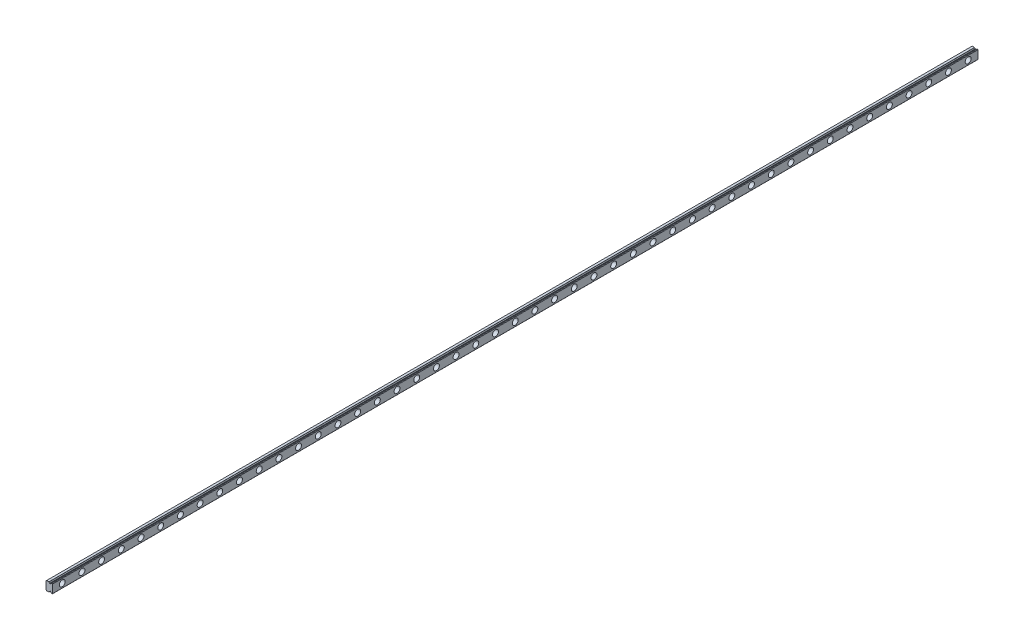
from build123d import *

# Parameters (mm, degrees)
EXTRUDE_1_DEPTH     = 940
SKETCH_2_R          = 3
CUT_EXTRUDE_1_DEPTH = 4.5
SKETCH_3_R          = 1.75
CUT_EXTRUDE_2_DEPTH = 941.05385484


with BuildPart() as part:
    # 草图1 → 凸台-拉伸1 (new body)
    with BuildSketch(Plane.XY):
        with BuildLine():
            Line((0.6, 9), (0, 8.4))
            Line((0, 8.4), (0, 0.6))
            Line((0, 0.6), (0.6, 0))
            Line((0.6, 0), (2.942330317, 0))
            ThreePointArc((2.942330317, 0), (3.055719659, 0.035249106), (3.129140272, 0.128571429))
            ThreePointArc((3.129140272, 0.128571429), (3.369153549, 0.514929157), (3.735714286, 0.784209483))
            ThreePointArc((3.735714286, 0.784209483), (3.819030851, 0.858006567), (3.85, 0.964911064))
            Line((3.85, 0.964911064), (3.85, 1))
            ThreePointArc((3.85, 1), (4.25, 1.4), (4.65, 1))
            Line((4.65, 1), (4.65, 0.964911064))
            ThreePointArc((4.65, 0.964911064), (4.680969149, 0.858006567), (4.764285714, 0.784209483))
            ThreePointArc((4.764285714, 0.784209483), (5.130846451, 0.514929157), (5.370859728, 0.128571429))
            ThreePointArc((5.370859728, 0.128571429), (5.444280341, 0.035249106), (5.557669683, 0))
            Line((5.557669683, 0), (6.2, 0))
            ThreePointArc((6.2, 0), (6.412132034, 0.087867966), (6.5, 0.3))
            Line((6.5, 0.3), (6.5, 8.7))
            ThreePointArc((6.5, 8.7), (6.412132034, 8.912132034), (6.2, 9))
            Line((6.2, 9), (5.557669683, 9))
            ThreePointArc((5.557669683, 9), (5.444280341, 8.964750894), (5.370859728, 8.871428571))
            ThreePointArc((5.370859728, 8.871428571), (5.130846451, 8.485070843), (4.764285714, 8.215790517))
            ThreePointArc((4.764285714, 8.215790517), (4.680969149, 8.141993433), (4.65, 8.035088936))
            Line((4.65, 8.035088936), (4.65, 8))
            ThreePointArc((4.65, 8), (4.25, 7.6), (3.85, 8))
            Line((3.85, 8), (3.85, 8.035088936))
            ThreePointArc((3.85, 8.035088936), (3.819030851, 8.141993433), (3.735714286, 8.215790517))
            ThreePointArc((3.735714286, 8.215790517), (3.369153549, 8.485070843), (3.129140272, 8.871428571))
            ThreePointArc((3.129140272, 8.871428571), (3.055719659, 8.964750894), (2.942330317, 9))
            Line((2.942330317, 9), (0.6, 9))
        make_face()
    extrude(amount=EXTRUDE_1_DEPTH)

    # 草图2 → 切除-拉伸1 (cut)
    with BuildSketch(Plane(origin=(6.5, 0, 0), x_dir=(0, 0, -1), z_dir=(1, 0, 0))):
        with Locations((-10, 4.5)):
            Circle(SKETCH_2_R)
        with Locations((-30, 4.5)):
            Circle(SKETCH_2_R)
        with Locations((-50, 4.5)):
            Circle(SKETCH_2_R)
        with Locations((-70, 4.5)):
            Circle(SKETCH_2_R)
        with Locations((-90, 4.5)):
            Circle(SKETCH_2_R)
        with Locations((-110, 4.5)):
            Circle(SKETCH_2_R)
        with Locations((-130, 4.5)):
            Circle(SKETCH_2_R)
        with Locations((-150, 4.5)):
            Circle(SKETCH_2_R)
        with Locations((-170, 4.5)):
            Circle(SKETCH_2_R)
        with Locations((-190, 4.5)):
            Circle(SKETCH_2_R)
        with Locations((-210, 4.5)):
            Circle(SKETCH_2_R)
        with Locations((-230, 4.5)):
            Circle(SKETCH_2_R)
        with Locations((-250, 4.5)):
            Circle(SKETCH_2_R)
        with Locations((-270, 4.5)):
            Circle(SKETCH_2_R)
        with Locations((-290, 4.5)):
            Circle(SKETCH_2_R)
        with Locations((-310, 4.5)):
            Circle(SKETCH_2_R)
        with Locations((-330, 4.5)):
            Circle(SKETCH_2_R)
        with Locations((-350, 4.5)):
            Circle(SKETCH_2_R)
        with Locations((-370, 4.5)):
            Circle(SKETCH_2_R)
        with Locations((-390, 4.5)):
            Circle(SKETCH_2_R)
        with Locations((-410, 4.5)):
            Circle(SKETCH_2_R)
        with Locations((-430, 4.5)):
            Circle(SKETCH_2_R)
        with Locations((-450, 4.5)):
            Circle(SKETCH_2_R)
        with Locations((-470, 4.5)):
            Circle(SKETCH_2_R)
        with Locations((-490, 4.5)):
            Circle(SKETCH_2_R)
        with Locations((-510, 4.5)):
            Circle(SKETCH_2_R)
        with Locations((-530, 4.5)):
            Circle(SKETCH_2_R)
        with Locations((-550, 4.5)):
            Circle(SKETCH_2_R)
        with Locations((-570, 4.5)):
            Circle(SKETCH_2_R)
        with Locations((-590, 4.5)):
            Circle(SKETCH_2_R)
        with Locations((-610, 4.5)):
            Circle(SKETCH_2_R)
        with Locations((-630, 4.5)):
            Circle(SKETCH_2_R)
        with Locations((-650, 4.5)):
            Circle(SKETCH_2_R)
        with Locations((-670, 4.5)):
            Circle(SKETCH_2_R)
        with Locations((-690, 4.5)):
            Circle(SKETCH_2_R)
        with Locations((-710, 4.5)):
            Circle(SKETCH_2_R)
        with Locations((-730, 4.5)):
            Circle(SKETCH_2_R)
        with Locations((-750, 4.5)):
            Circle(SKETCH_2_R)
        with Locations((-770, 4.5)):
            Circle(SKETCH_2_R)
        with Locations((-790, 4.5)):
            Circle(SKETCH_2_R)
        with Locations((-810, 4.5)):
            Circle(SKETCH_2_R)
        with Locations((-830, 4.5)):
            Circle(SKETCH_2_R)
        with Locations((-850, 4.5)):
            Circle(SKETCH_2_R)
        with Locations((-870, 4.5)):
            Circle(SKETCH_2_R)
        with Locations((-890, 4.5)):
            Circle(SKETCH_2_R)
        with Locations((-910, 4.5)):
            Circle(SKETCH_2_R)
        with Locations((-930, 4.5)):
            Circle(SKETCH_2_R)
        with Locations((-950, 4.5)):
            Circle(SKETCH_2_R)
        with Locations((-970, 4.5)):
            Circle(SKETCH_2_R)
        with Locations((-990, 4.5)):
            Circle(SKETCH_2_R)
        with Locations((-1010, 4.5)):
            Circle(SKETCH_2_R)
        with Locations((-1030, 4.5)):
            Circle(SKETCH_2_R)
        with Locations((-1050, 4.5)):
            Circle(SKETCH_2_R)
        with Locations((-1070, 4.5)):
            Circle(SKETCH_2_R)
        with Locations((-1090, 4.5)):
            Circle(SKETCH_2_R)
        with Locations((-1110, 4.5)):
            Circle(SKETCH_2_R)
        with Locations((-1130, 4.5)):
            Circle(SKETCH_2_R)
        with Locations((-1150, 4.5)):
            Circle(SKETCH_2_R)
        with Locations((-1170, 4.5)):
            Circle(SKETCH_2_R)
        with Locations((-1190, 4.5)):
            Circle(SKETCH_2_R)
        with Locations((-1210, 4.5)):
            Circle(SKETCH_2_R)
        with Locations((-1230, 4.5)):
            Circle(SKETCH_2_R)
        with Locations((-1250, 4.5)):
            Circle(SKETCH_2_R)
        with Locations((-1270, 4.5)):
            Circle(SKETCH_2_R)
        with Locations((-1290, 4.5)):
            Circle(SKETCH_2_R)
        with Locations((-1310, 4.5)):
            Circle(SKETCH_2_R)
        with Locations((-1330, 4.5)):
            Circle(SKETCH_2_R)
        with Locations((-1350, 4.5)):
            Circle(SKETCH_2_R)
        with Locations((-1370, 4.5)):
            Circle(SKETCH_2_R)
        with Locations((-1390, 4.5)):
            Circle(SKETCH_2_R)
        with Locations((-1410, 4.5)):
            Circle(SKETCH_2_R)
        with Locations((-1430, 4.5)):
            Circle(SKETCH_2_R)
        with Locations((-1450, 4.5)):
            Circle(SKETCH_2_R)
        with Locations((-1470, 4.5)):
            Circle(SKETCH_2_R)
        with Locations((-1490, 4.5)):
            Circle(SKETCH_2_R)
        with Locations((-1510, 4.5)):
            Circle(SKETCH_2_R)
        with Locations((-1530, 4.5)):
            Circle(SKETCH_2_R)
        with Locations((-1550, 4.5)):
            Circle(SKETCH_2_R)
        with Locations((-1570, 4.5)):
            Circle(SKETCH_2_R)
        with Locations((-1590, 4.5)):
            Circle(SKETCH_2_R)
        with Locations((-1610, 4.5)):
            Circle(SKETCH_2_R)
        with Locations((-1630, 4.5)):
            Circle(SKETCH_2_R)
        with Locations((-1650, 4.5)):
            Circle(SKETCH_2_R)
        with Locations((-1670, 4.5)):
            Circle(SKETCH_2_R)
        with Locations((-1690, 4.5)):
            Circle(SKETCH_2_R)
        with Locations((-1710, 4.5)):
            Circle(SKETCH_2_R)
        with Locations((-1730, 4.5)):
            Circle(SKETCH_2_R)
        with Locations((-1750, 4.5)):
            Circle(SKETCH_2_R)
        with Locations((-1770, 4.5)):
            Circle(SKETCH_2_R)
        with Locations((-1790, 4.5)):
            Circle(SKETCH_2_R)
        with Locations((-1810, 4.5)):
            Circle(SKETCH_2_R)
        with Locations((-1830, 4.5)):
            Circle(SKETCH_2_R)
        with Locations((-1850, 4.5)):
            Circle(SKETCH_2_R)
        with Locations((-1870, 4.5)):
            Circle(SKETCH_2_R)
        with Locations((-1890, 4.5)):
            Circle(SKETCH_2_R)
        with Locations((-1910, 4.5)):
            Circle(SKETCH_2_R)
        with Locations((-1930, 4.5)):
            Circle(SKETCH_2_R)
        with Locations((-1950, 4.5)):
            Circle(SKETCH_2_R)
        with Locations((-1970, 4.5)):
            Circle(SKETCH_2_R)
        with Locations((-1990, 4.5)):
            Circle(SKETCH_2_R)
        with Locations((-2010, 4.5)):
            Circle(SKETCH_2_R)
        with Locations((-2030, 4.5)):
            Circle(SKETCH_2_R)
        with Locations((-2050, 4.5)):
            Circle(SKETCH_2_R)
        with Locations((-2070, 4.5)):
            Circle(SKETCH_2_R)
        with Locations((-2090, 4.5)):
            Circle(SKETCH_2_R)
        with Locations((-2110, 4.5)):
            Circle(SKETCH_2_R)
        with Locations((-2130, 4.5)):
            Circle(SKETCH_2_R)
        with Locations((-2150, 4.5)):
            Circle(SKETCH_2_R)
        with Locations((-2170, 4.5)):
            Circle(SKETCH_2_R)
        with Locations((-2190, 4.5)):
            Circle(SKETCH_2_R)
        with Locations((-2210, 4.5)):
            Circle(SKETCH_2_R)
        with Locations((-2230, 4.5)):
            Circle(SKETCH_2_R)
        with Locations((-2250, 4.5)):
            Circle(SKETCH_2_R)
        with Locations((-2270, 4.5)):
            Circle(SKETCH_2_R)
        with Locations((-2290, 4.5)):
            Circle(SKETCH_2_R)
        with Locations((-2310, 4.5)):
            Circle(SKETCH_2_R)
        with Locations((-2330, 4.5)):
            Circle(SKETCH_2_R)
        with Locations((-2350, 4.5)):
            Circle(SKETCH_2_R)
        with Locations((-2370, 4.5)):
            Circle(SKETCH_2_R)
        with Locations((-2390, 4.5)):
            Circle(SKETCH_2_R)
        with Locations((-2410, 4.5)):
            Circle(SKETCH_2_R)
        with Locations((-2430, 4.5)):
            Circle(SKETCH_2_R)
        with Locations((-2450, 4.5)):
            Circle(SKETCH_2_R)
        with Locations((-2470, 4.5)):
            Circle(SKETCH_2_R)
    extrude(amount=-CUT_EXTRUDE_1_DEPTH, mode=Mode.SUBTRACT)

    # 草图3 → 切除-拉伸2 (cut, through all)
    with BuildSketch(Plane(origin=(2, 0, 0), x_dir=(0, 0, -1), z_dir=(1, 0, 0))):
        with Locations((-10, 4.5)):
            Circle(SKETCH_3_R)
        with Locations((-30, 4.5)):
            Circle(SKETCH_3_R)
        with Locations((-50, 4.5)):
            Circle(SKETCH_3_R)
        with Locations((-70, 4.5)):
            Circle(SKETCH_3_R)
        with Locations((-90, 4.5)):
            Circle(SKETCH_3_R)
        with Locations((-110, 4.5)):
            Circle(SKETCH_3_R)
        with Locations((-130, 4.5)):
            Circle(SKETCH_3_R)
        with Locations((-150, 4.5)):
            Circle(SKETCH_3_R)
        with Locations((-170, 4.5)):
            Circle(SKETCH_3_R)
        with Locations((-190, 4.5)):
            Circle(SKETCH_3_R)
        with Locations((-210, 4.5)):
            Circle(SKETCH_3_R)
        with Locations((-230, 4.5)):
            Circle(SKETCH_3_R)
        with Locations((-250, 4.5)):
            Circle(SKETCH_3_R)
        with Locations((-270, 4.5)):
            Circle(SKETCH_3_R)
        with Locations((-290, 4.5)):
            Circle(SKETCH_3_R)
        with Locations((-310, 4.5)):
            Circle(SKETCH_3_R)
        with Locations((-330, 4.5)):
            Circle(SKETCH_3_R)
        with Locations((-350, 4.5)):
            Circle(SKETCH_3_R)
        with Locations((-370, 4.5)):
            Circle(SKETCH_3_R)
        with Locations((-390, 4.5)):
            Circle(SKETCH_3_R)
        with Locations((-410, 4.5)):
            Circle(SKETCH_3_R)
        with Locations((-430, 4.5)):
            Circle(SKETCH_3_R)
        with Locations((-450, 4.5)):
            Circle(SKETCH_3_R)
        with Locations((-470, 4.5)):
            Circle(SKETCH_3_R)
        with Locations((-490, 4.5)):
            Circle(SKETCH_3_R)
        with Locations((-510, 4.5)):
            Circle(SKETCH_3_R)
        with Locations((-530, 4.5)):
            Circle(SKETCH_3_R)
        with Locations((-550, 4.5)):
            Circle(SKETCH_3_R)
        with Locations((-570, 4.5)):
            Circle(SKETCH_3_R)
        with Locations((-590, 4.5)):
            Circle(SKETCH_3_R)
        with Locations((-610, 4.5)):
            Circle(SKETCH_3_R)
        with Locations((-630, 4.5)):
            Circle(SKETCH_3_R)
        with Locations((-650, 4.5)):
            Circle(SKETCH_3_R)
        with Locations((-670, 4.5)):
            Circle(SKETCH_3_R)
        with Locations((-690, 4.5)):
            Circle(SKETCH_3_R)
        with Locations((-710, 4.5)):
            Circle(SKETCH_3_R)
        with Locations((-730, 4.5)):
            Circle(SKETCH_3_R)
        with Locations((-750, 4.5)):
            Circle(SKETCH_3_R)
        with Locations((-770, 4.5)):
            Circle(SKETCH_3_R)
        with Locations((-790, 4.5)):
            Circle(SKETCH_3_R)
        with Locations((-810, 4.5)):
            Circle(SKETCH_3_R)
        with Locations((-830, 4.5)):
            Circle(SKETCH_3_R)
        with Locations((-850, 4.5)):
            Circle(SKETCH_3_R)
        with Locations((-870, 4.5)):
            Circle(SKETCH_3_R)
        with Locations((-890, 4.5)):
            Circle(SKETCH_3_R)
        with Locations((-910, 4.5)):
            Circle(SKETCH_3_R)
        with Locations((-930, 4.5)):
            Circle(SKETCH_3_R)
        with Locations((-950, 4.5)):
            Circle(SKETCH_3_R)
        with Locations((-970, 4.5)):
            Circle(SKETCH_3_R)
        with Locations((-990, 4.5)):
            Circle(SKETCH_3_R)
        with Locations((-1010, 4.5)):
            Circle(SKETCH_3_R)
        with Locations((-1030, 4.5)):
            Circle(SKETCH_3_R)
        with Locations((-1050, 4.5)):
            Circle(SKETCH_3_R)
        with Locations((-1070, 4.5)):
            Circle(SKETCH_3_R)
    extrude(amount=-CUT_EXTRUDE_2_DEPTH, mode=Mode.SUBTRACT)


solid = part.part
